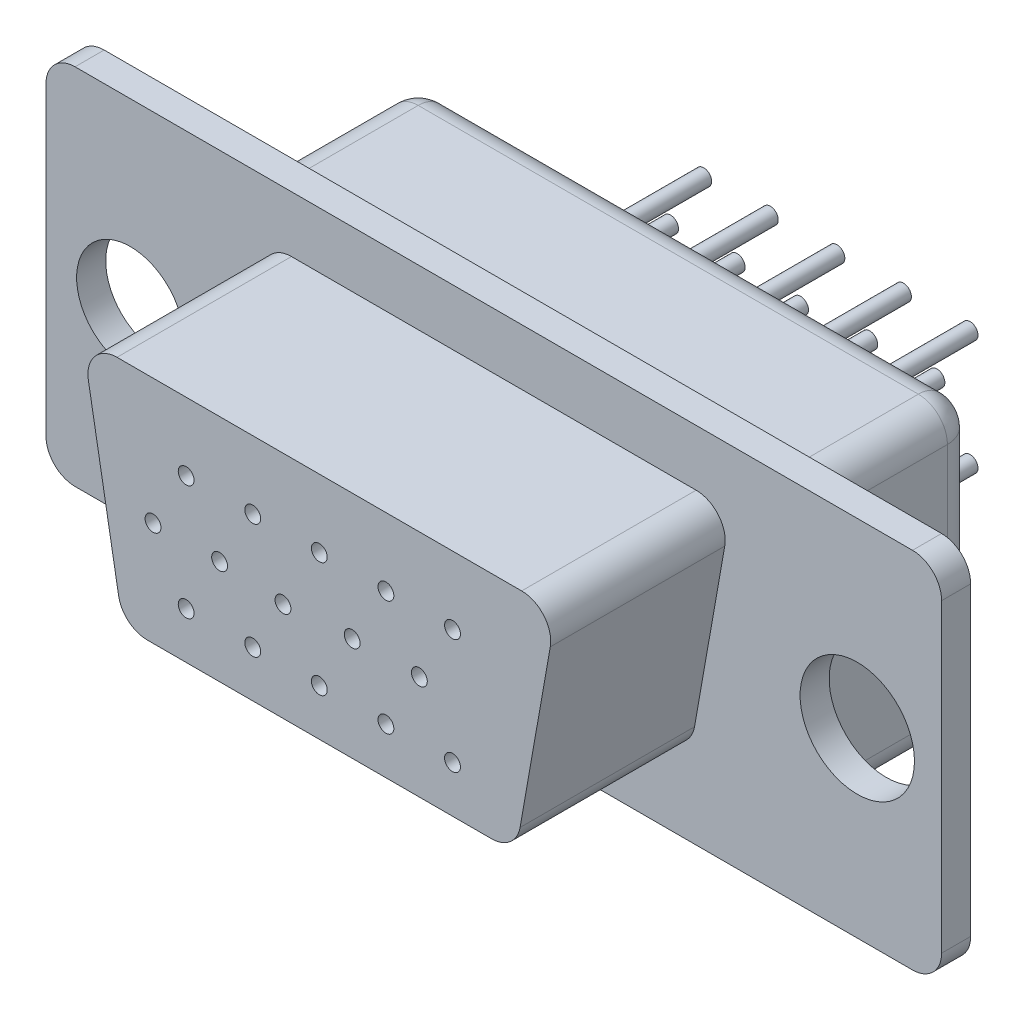
from build123d import *

# Parameters (mm, degrees)
ESQUISSE1_W      = 30.8
ESQUISSE1_H      = 12.5
ESQUISSE1_R      = 1.847277142
ESQUISSE1_R_2    = 1.96687405
EXTRUSION1_DEPTH = 1
EXTRUSION2_DEPTH = 6
ESQUISSE3_W      = 19.2
ESQUISSE3_H      = 10
EXTRUSION3_DEPTH = 6
ESQUISSE4_R      = 0.272537765
EXTRUSION4_DEPTH = 4.8
CONG_1_R         = 1
EXTRUSION5_START = 6
ESQUISSE7_R      = 0.272537765
EXTRUSION5_DEPTH = 6


with BuildPart() as part:
    # Esquisse1 → Extrusion1 (new body)
    with BuildSketch(Plane.XY):
        with Locations((15.4, 6.25)):
            Rectangle(ESQUISSE1_W, ESQUISSE1_H)
        with Locations((2.9, 6.25)):
            Circle(ESQUISSE1_R, mode=Mode.SUBTRACT)
        with Locations((27.9, 6.25)):
            Circle(ESQUISSE1_R_2, mode=Mode.SUBTRACT)
    extrude(amount=EXTRUSION1_DEPTH)

    # Esquisse2 → Extrusion2 (add)
    with BuildSketch(Plane.XY.offset(1)):
        with BuildLine():
            Line((8.441753593, 10.569106944), (22.358246407, 10.569106944))
            ThreePointArc((22.358246407, 10.569106944), (23.124290851, 10.211894554), (23.34305416, 9.395458766))
            Line((23.34305416, 9.395458766), (22.302724974, 3.495458766))
            ThreePointArc((22.302724974, 3.495458766), (21.960704831, 2.903062501), (21.317917221, 2.669106944))
            Line((21.317917221, 2.669106944), (9.482082779, 2.669106944))
            ThreePointArc((9.482082779, 2.669106944), (8.839295169, 2.903062501), (8.497275026, 3.495458766))
            Line((8.497275026, 3.495458766), (7.45694584, 9.395458766))
            ThreePointArc((7.45694584, 9.395458766), (7.675709149, 10.211894554), (8.441753593, 10.569106944))
        make_face()
    extrude(amount=EXTRUSION2_DEPTH)

    # Esquisse3 → Extrusion3 (add)
    with BuildSketch(Plane(origin=(0, 0, 0), x_dir=(-1, 0, 0), z_dir=(0, 0, -1))):
        with Locations((-15.4, 6.25)):
            Rectangle(ESQUISSE3_W, ESQUISSE3_H)
    extrude(amount=EXTRUSION3_DEPTH)

    # Esquisse4 → Extrusion4 (add)
    with BuildSketch(Plane(origin=(0, 0, -6), x_dir=(-1, 0, 0), z_dir=(0, 0, -1))):
        with Locations((-19.98, 8.23)):
            Circle(ESQUISSE4_R)
        with Locations((-17.69, 8.23)):
            Circle(ESQUISSE4_R)
        with Locations((-15.4, 8.23)):
            Circle(ESQUISSE4_R)
        with Locations((-13.11, 8.23)):
            Circle(ESQUISSE4_R)
        with Locations((-10.82, 8.23)):
            Circle(ESQUISSE4_R)
        with Locations((-9.68, 6.25)):
            Circle(ESQUISSE4_R)
        with Locations((-11.97, 6.25)):
            Circle(ESQUISSE4_R)
        with Locations((-14.149725584, 6.068095869)):
            Circle(ESQUISSE4_R)
        with Locations((-16.529732269, 6.22882427)):
            Circle(ESQUISSE4_R)
        with Locations((-18.84, 6.25)):
            Circle(ESQUISSE4_R)
        with Locations((-19.98, 4.27)):
            Circle(ESQUISSE4_R)
        with Locations((-17.69, 4.27)):
            Circle(ESQUISSE4_R)
        with Locations((-15.4, 4.27)):
            Circle(ESQUISSE4_R)
        with Locations((-13.11, 4.27)):
            Circle(ESQUISSE4_R)
        with Locations((-10.82, 4.27)):
            Circle(ESQUISSE4_R)
    extrude(amount=EXTRUSION4_DEPTH)

    # Congé1
    cong_1_edges = [part.edges().sort_by_distance(p)[0] for p in [
        (25, 11.25, -3),
        (25, 1.25, -3),
        (5.8, 1.25, -3),
        (5.8, 11.25, -3),
        (25, 6.25, -6),
        (15.4, 1.25, -6),
        (5.8, 6.25, -6),
        (15.4, 11.25, -6),
        (0, 12.5, 0.5),
        (30.8, 12.5, 0.5),
        (30.8, 0, 0.5),
        (0, 0, 0.5),
    ]]
    fillet(cong_1_edges, radius=CONG_1_R)

    # Esquisse7 → Extrusion5 (cut)
    with BuildSketch(Plane.XY.offset(1).offset(EXTRUSION5_START)):
        with Locations(Location((19.98, 8.23, 0), (0, 0, 180))):
            Circle(ESQUISSE7_R)
        with Locations(Location((17.69, 8.23, 0), (0, 0, 180))):
            Circle(ESQUISSE7_R)
        with Locations(Location((15.4, 8.23, 0), (0, 0, 180))):
            Circle(ESQUISSE7_R)
        with Locations(Location((13.11, 8.23, 0), (0, 0, 180))):
            Circle(ESQUISSE7_R)
        with Locations(Location((10.82, 8.23, 0), (0, 0, 180))):
            Circle(ESQUISSE7_R)
        with Locations(Location((9.68, 6.25, 0), (0, 0, 180))):
            Circle(ESQUISSE7_R)
        with Locations(Location((11.97, 6.25, 0), (0, 0, 180))):
            Circle(ESQUISSE7_R)
        with Locations(Location((14.149725584, 6.068095869, 0), (0, 0, 180))):
            Circle(ESQUISSE7_R)
        with Locations(Location((16.529732269, 6.22882427, 0), (0, 0, 180))):
            Circle(ESQUISSE7_R)
        with Locations(Location((18.84, 6.25, 0), (0, 0, 180))):
            Circle(ESQUISSE7_R)
        with Locations(Location((19.98, 4.27, 0), (0, 0, 180))):
            Circle(ESQUISSE7_R)
        with Locations(Location((17.69, 4.27, 0), (0, 0, 180))):
            Circle(ESQUISSE7_R)
        with Locations(Location((15.4, 4.27, 0), (0, 0, 180))):
            Circle(ESQUISSE7_R)
        with Locations(Location((13.11, 4.27, 0), (0, 0, 180))):
            Circle(ESQUISSE7_R)
        with Locations(Location((10.82, 4.27, 0), (0, 0, 180))):
            Circle(ESQUISSE7_R)
    extrude(amount=-EXTRUSION5_DEPTH, mode=Mode.SUBTRACT)


solid = part.part
